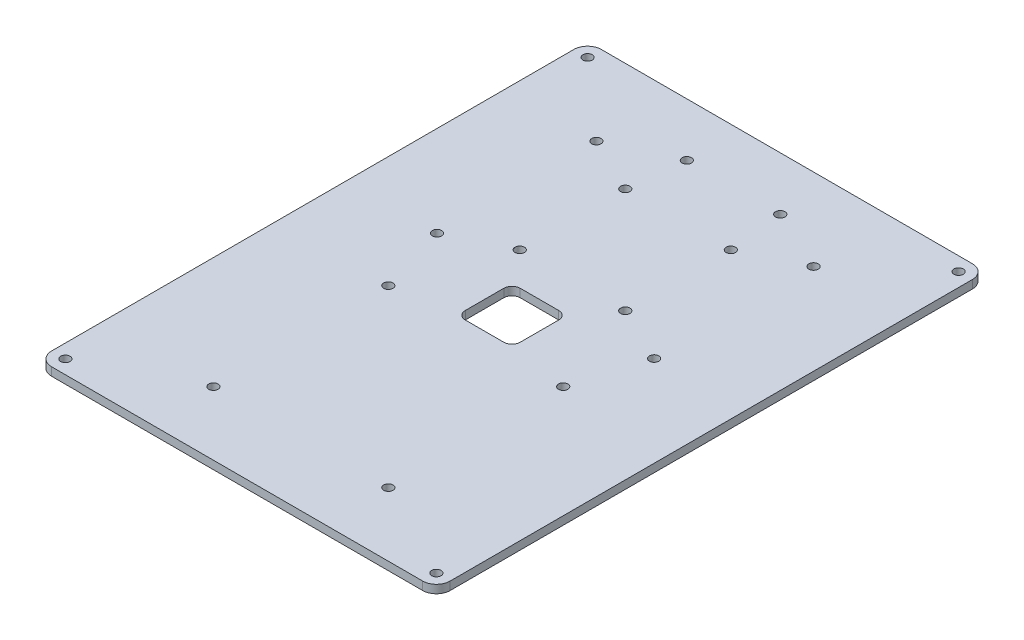
from build123d import *

# Parameters (mm, degrees)
SKETCH_1_R      = 1.7
EXTRUDE_1_DEPTH = 3


with BuildPart() as part:
    # 草图1 → 凸台-拉伸1 (new body)
    with BuildSketch(Plane(origin=(0, 0, 0), x_dir=(1, 0, 0), z_dir=(0, 1, 0))):
        with BuildLine():
            Line((-67.5, -100), (67.5, -100))
            ThreePointArc((67.5, -100), (71.035533906, -98.535533906), (72.5, -95))
            Line((72.5, -95), (72.5, 95))
            ThreePointArc((72.5, 95), (71.035533906, 98.535533906), (67.5, 100))
            Line((67.5, 100), (-67.5, 100))
            ThreePointArc((-67.5, 100), (-71.035533906, 98.535533906), (-72.5, 95))
            Line((-72.5, 95), (-72.5, -95))
            ThreePointArc((-72.5, -95), (-71.035533906, -98.535533906), (-67.5, -100))
        make_face()
        with Locations(Location((-67.5, 95, 0), (0, 0, 270))):
            Circle(SKETCH_1_R, mode=Mode.SUBTRACT)
        with Locations(Location((67.5, 95, 0), (0, 0, 270))):
            Circle(SKETCH_1_R, mode=Mode.SUBTRACT)
        with Locations(Location((67.5, -95, 0), (0, 0, 270))):
            Circle(SKETCH_1_R, mode=Mode.SUBTRACT)
        with Locations(Location((-67.5, -95, 0), (0, 0, 270))):
            Circle(SKETCH_1_R, mode=Mode.SUBTRACT)
        with Locations(Location((-39.5, 70.215403043, 0), (0, 0, 270))):
            Circle(SKETCH_1_R, mode=Mode.SUBTRACT)
        with Locations(Location((-39.5, 12.215403043, 0), (0, 0, 270))):
            Circle(SKETCH_1_R, mode=Mode.SUBTRACT)
        with Locations(Location((39.5, 12.215403043, 0), (0, 0, 270))):
            Circle(SKETCH_1_R, mode=Mode.SUBTRACT)
        with Locations(Location((39.5, 70.215403043, 0), (0, 0, 270))):
            Circle(SKETCH_1_R, mode=Mode.SUBTRACT)
        with Locations(Location((-17, 80.610004264, 0), (0, 0, 270))):
            Circle(SKETCH_1_R, mode=Mode.SUBTRACT)
        with Locations(Location((17, 80.610004264, 0), (0, 0, 270))):
            Circle(SKETCH_1_R, mode=Mode.SUBTRACT)
        with Locations(Location((-31.819805153, -13.180194847, 0), (0, 0, 270))):
            Circle(SKETCH_1_R, mode=Mode.SUBTRACT)
        with Locations(Location((31.819805153, -13.180194847, 0), (0, 0, 270))):
            Circle(SKETCH_1_R, mode=Mode.SUBTRACT)
        with Locations(Location((31.819805153, -76.819805153, 0), (0, 0, 270))):
            Circle(SKETCH_1_R, mode=Mode.SUBTRACT)
        with Locations(Location((-31.819805153, -76.819805153, 0), (0, 0, 270))):
            Circle(SKETCH_1_R, mode=Mode.SUBTRACT)
        with Locations(Location((-19.2, 60.415403043, 0), (0, 0, 270))):
            Circle(SKETCH_1_R, mode=Mode.SUBTRACT)
        with Locations(Location((19.2, 60.415403043, 0), (0, 0, 270))):
            Circle(SKETCH_1_R, mode=Mode.SUBTRACT)
        with Locations(Location((19.2, 22.015403043, 0), (0, 0, 270))):
            Circle(SKETCH_1_R, mode=Mode.SUBTRACT)
        with Locations(Location((-19.2, 22.015403043, 0), (0, 0, 270))):
            Circle(SKETCH_1_R, mode=Mode.SUBTRACT)
        with BuildLine():
            Line((-7, 10), (7, 10))
            ThreePointArc((7, 10), (9.121320344, 9.121320344), (10, 7))
            Line((10, 7), (10, -7))
            ThreePointArc((10, -7), (9.121320344, -9.121320344), (7, -10))
            Line((7, -10), (-7, -10))
            ThreePointArc((-7, -10), (-9.121320344, -9.121320344), (-10, -7))
            Line((-10, -7), (-10, 7))
            ThreePointArc((-10, 7), (-9.121320344, 9.121320344), (-7, 10))
        make_face(mode=Mode.SUBTRACT)
    extrude(amount=EXTRUDE_1_DEPTH)


solid = part.part
